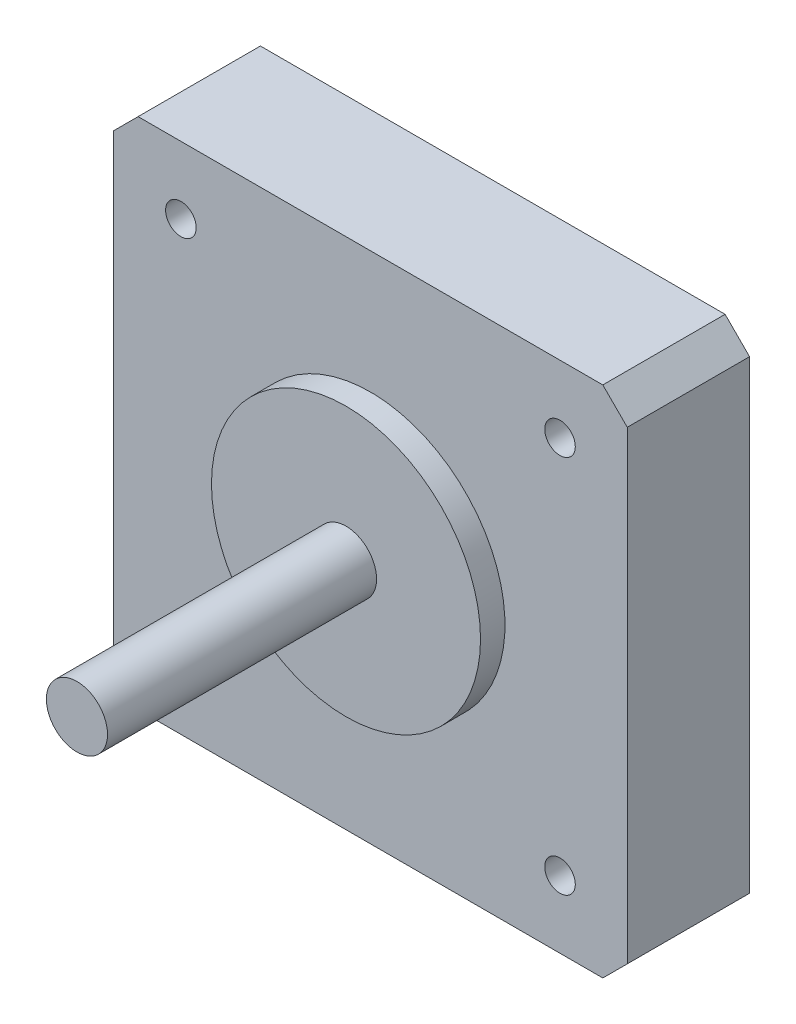
from build123d import *

# Parameters (mm, degrees)
SKETCH_1_W               = 42
SKETCH_1_H               = 42
EXTRUDE_1_DEPTH          = 10
SKETCH_2_R               = 2.5
EXTRUDE_2_DEPTH          = 24
SKETCH_3_R               = 11
EXTRUDE_3_DEPTH          = 2
CHAMFER_1_SIZE           = 2
PATTERN_CIRCULAR_2_COUNT = 4


with BuildPart() as part:
    # 草图1 → 凸台-拉伸1 (new body)
    with BuildSketch(Plane.XY):
        Rectangle(SKETCH_1_W, SKETCH_1_H)
    extrude(amount=EXTRUDE_1_DEPTH)

    # 草图2 → 凸台-拉伸2 (add)
    with BuildSketch(Plane.XY.offset(10)):
        with Locations(Location((0, 0, 0), (0, 0, 180))):
            Circle(SKETCH_2_R)
    extrude(amount=EXTRUDE_2_DEPTH)

    # 草图3 → 凸台-拉伸3 (add)
    with BuildSketch(Plane.XY.offset(10)):
        with Locations(Location((0, 0, 0), (0, 0, 180))):
            Circle(SKETCH_3_R)
    extrude(amount=EXTRUDE_3_DEPTH)

    # 倒角1
    chamfer_1_edges = [part.edges().sort_by_distance(p)[0] for p in [
        (21, -21, 5),
        (-21, -21, 5),
        (-21, 21, 5),
        (21, 21, 5),
    ]]
    chamfer(chamfer_1_edges, length=CHAMFER_1_SIZE)

    # 草图5 → M3 螺纹孔1 (revolve, cut)
    with BuildSketch(Plane(origin=(15.5, 15.5, 10), x_dir=(0, -1, 0), z_dir=(1, 0, 0))):
        Polygon((0, 0), (0, 8.251075774), (1.25, 7.5), (1.25, 0), align=None)
    hole_wizard_m3_1 = revolve(axis=Axis((15.5, 15.5, 16.35), (0, 0, -1)), mode=Mode.SUBTRACT)

    # 阵列(圆周)2: M3 螺纹孔1 ×4 about axis
    pattern_circular_2_axis = Axis((0, 0, 0), (0, 0, 1))
    for i in range(1, PATTERN_CIRCULAR_2_COUNT):
        add(hole_wizard_m3_1.rotate(pattern_circular_2_axis, i * 360 / PATTERN_CIRCULAR_2_COUNT), mode=Mode.SUBTRACT)


solid = part.part
